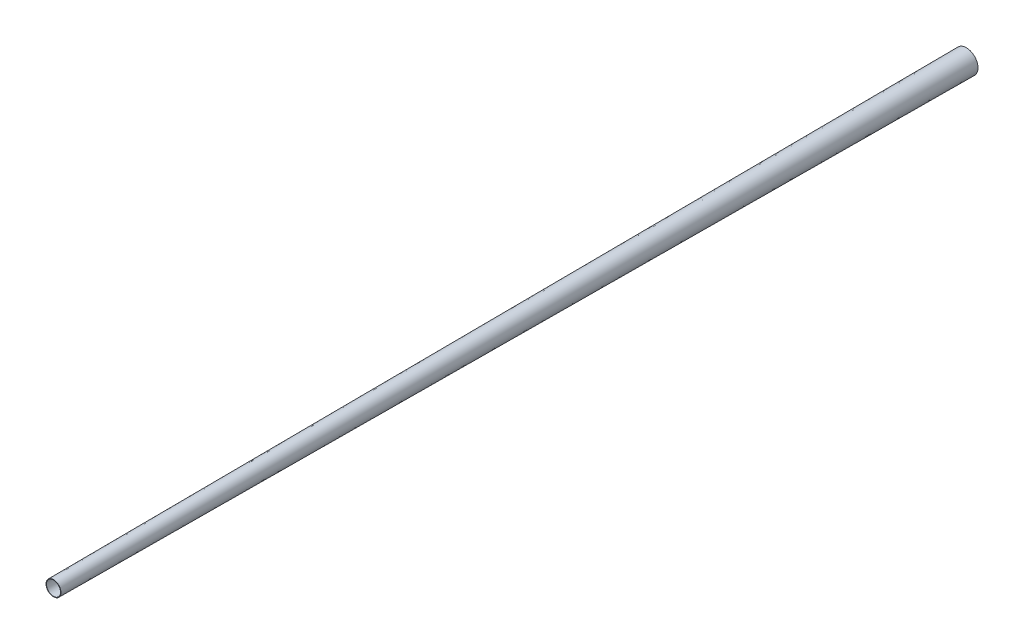
from build123d import *

# Parameters (mm, degrees)
SKETCH3_R = 7.9883
SKETCH1_R = 12.7
SHELL1_T  = 0.508


with BuildPart() as part:
    # Sketch3 → Loft1 section 0
    with BuildSketch(Plane.XY.offset(1035.05)):
        Circle(SKETCH3_R)
    # Sketch1 → Loft1 section 1
    with BuildSketch(Plane.XY):
        Circle(SKETCH1_R)
    loft()

    # Shell1
    shell1_openings = [part.faces().sort_by_distance(p)[0] for p in [
        (0, 0, 1035.05),
        (0, 0, 0),
    ]]
    offset(amount=SHELL1_T, openings=shell1_openings, kind=Kind.INTERSECTION)


solid = part.part
